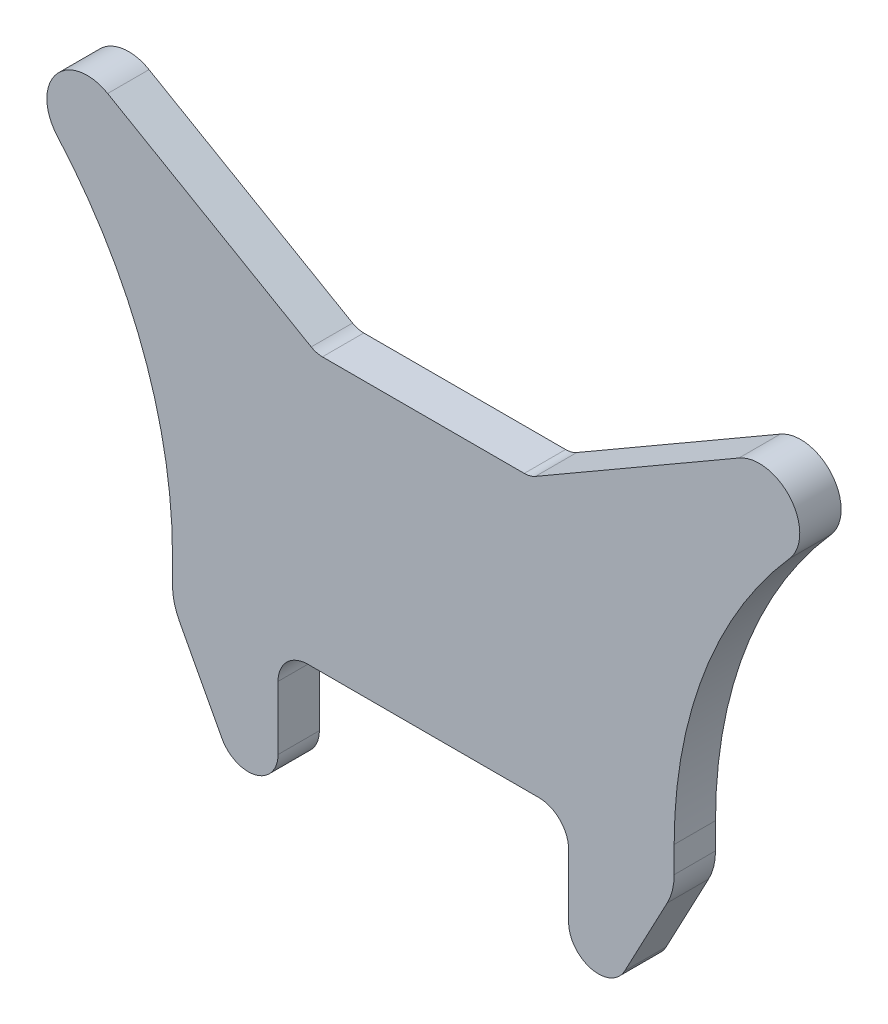
from build123d import *

# Parameters (mm, degrees)
RESSALTO_EXTRUS_O1_DEPTH = 5.55


with BuildPart() as part:
    # Esboço1 → Ressalto-extrusão1 (new body)
    with BuildSketch(Plane.XY):
        with BuildLine():
            Line((-15.5, -28.119565217), (15.5, -28.119565217))
            ThreePointArc((15.5, -28.119565217), (18.328427125, -29.291138093), (19.5, -32.119565217))
            Line((19.5, -32.119565217), (19.5, -40.619565217))
            ThreePointArc((19.5, -40.619565217), (22.534152087, -44.501206341), (27.033568905, -42.494102706))
            Line((27.033568905, -42.494102706), (32.73188308, -31.75258065))
            ThreePointArc((32.73188308, -31.75258065), (33.428027517, -29.935201499), (33.664745271, -28.003505673))
            Line((33.664745271, -28.003505673), (33.664745271, -24.494102706))
            ThreePointArc((33.664745271, -24.494102706), (37.669109742, -2.578069762), (49.164745271, 16.505897294))
            ThreePointArc((49.164745271, 16.505897294), (49.287222325, 23.539892597), (42.362401343, 24.780434783))
            Line((42.362401343, 24.780434783), (15.046868421, 8.983444446))
            ThreePointArc((15.046868421, 8.983444446), (14.322494504, 8.682938362), (13.544989202, 8.580434783))
            Line((13.544989202, 8.580434783), (-13.544989202, 8.580434783))
            ThreePointArc((-13.544989202, 8.580434783), (-14.322494504, 8.682938362), (-15.046868421, 8.983444446))
            Line((-15.046868421, 8.983444446), (-42.362401343, 24.780434783))
            ThreePointArc((-42.362401343, 24.780434783), (-49.287222325, 23.539892597), (-49.164745271, 16.505897294))
            ThreePointArc((-49.164745271, 16.505897294), (-37.669109742, -2.578069762), (-33.664745271, -24.494102706))
            Line((-33.664745271, -24.494102706), (-33.664745271, -28.003505673))
            ThreePointArc((-33.664745271, -28.003505673), (-33.428027517, -29.935201499), (-32.73188308, -31.75258065))
            Line((-32.73188308, -31.75258065), (-27.033568905, -42.494102706))
            ThreePointArc((-27.033568905, -42.494102706), (-22.534152087, -44.501206341), (-19.5, -40.619565217))
            Line((-19.5, -40.619565217), (-19.5, -32.119565217))
            ThreePointArc((-19.5, -32.119565217), (-18.328427125, -29.291138093), (-15.5, -28.119565217))
        make_face()
    extrude(amount=RESSALTO_EXTRUS_O1_DEPTH)


solid = part.part
